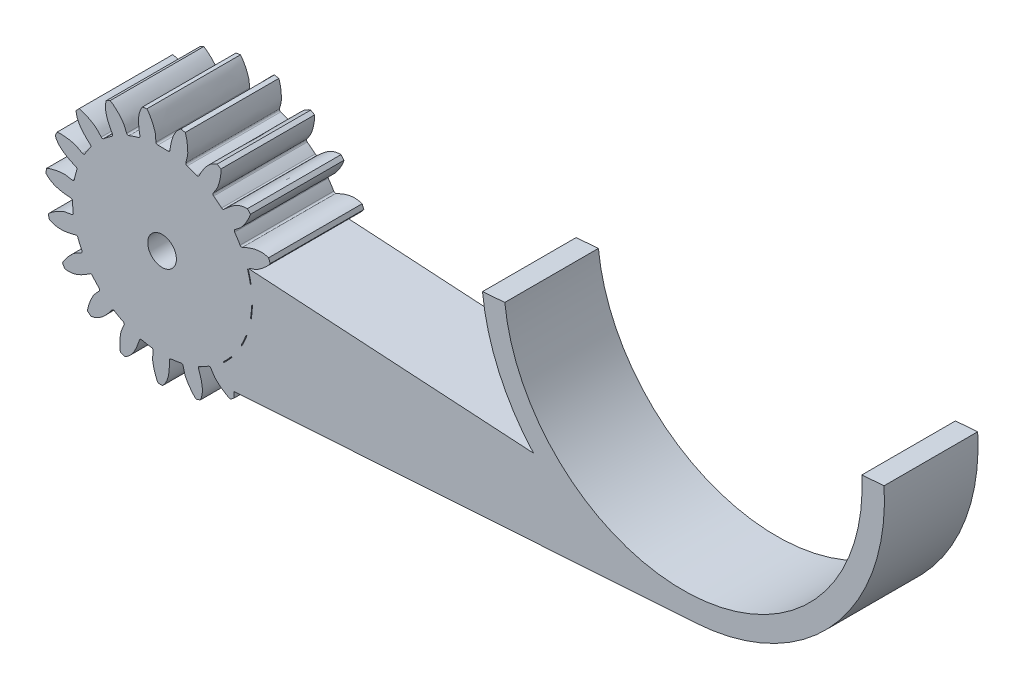
from build123d import *

# Parameters (mm, degrees)
SKETCH_3_R               = 13
SKETCH_3_R_2             = 10
EXTRUDE_1_DEPTH          = 4
CUT_EXTRUDE_2_DEPTH      = 19.814887722
PATTERN_CIRCULAR_4_COUNT = 19
CUT_EXTRUDE_4_DEPTH      = 19.804447773
CUT_EXTRUDE_4_DEPTH_BACK = 19.804447773
SKETCH_8_R               = 4.05
SKETCH_10_R              = 4.5
CUT_EXTRUDE_5_DEPTH      = 0.6
CUT_EXTRUDE_START        = -0.6
SKETCH_11_R              = 4.5
CUT_EXTRUDE_6_DEPTH      = 0.6
EXTRUDE_START            = 6.45
EXTRUDE_6_DEPTH          = 6.45
CUT_EXTRUDE_7_DEPTH      = 20.473308824
CUT_EXTRUDE_7_DEPTH_BACK = 20.473308824
SKETCH_16_R              = 1.6
EXTRUDE_7_DEPTH          = 4
EXTRUDE_8_DEPTH          = 6.45


with BuildPart() as part:
    # 草图3 → 凸台-拉伸1 (new body)
    # profile 1 of 2: a face of its own
    with BuildSketch(Plane.XY):
        Circle(SKETCH_3_R)
        Circle(SKETCH_3_R_2, mode=Mode.SUBTRACT)
    # profile 2 of 2: a face of its own
    with BuildSketch(Plane.XY):
        Circle(SKETCH_3_R_2)
    extrude(amount=EXTRUDE_1_DEPTH)

    # 草图6 → 切除-拉伸2 (cut, symmetric)
    with BuildSketch(Plane.XY.offset(4)):
        with BuildLine():
            Line((-1.696840499, 12.888783198), (-1.873622587, 14.231576474))
            Line((-1.873622587, 14.231576474), (3.000861464, 14.403965519))
            Line((3.000861464, 14.403965519), (2.084995297, 12.83171051))
            add(Edge.make_bspline(
                [(2.084995297, 12.83171051), (1.471750903, 12.385409064), (1.073531879, 11.424223458), (0.908091171, 10.424013275), (0.866775265, 10.148389403)],
                knots=[0, 0, 0, 0, 0.67611985, 0.94077492, 0.94077492, 0.94077492, 0.94077492], degree=3))
            ThreePointArc((0.866775265, 10.148389403), (0.794461275, 10.022295574), (0.655867727, 9.978468696))
            ThreePointArc((0.655867727, 9.978468696), (0.089873577, 9.999596129), (-0.476408885, 9.988645282))
            ThreePointArc((-0.476408885, 9.988645282), (-0.618800498, 10.03892803), (-0.685447576, 10.174434093))
            add(Edge.make_bspline(
                [(-1.696840499, 12.888783198), (-1.34037548, 12.491366053), (-0.721854022, 11.223575025), (-0.721476087, 10.688451407), (-0.685447576, 10.174434093)],
                knots=[0, 0, 0, 0, 0.6442443, 0.94077492, 0.94077492, 0.94077492, 0.94077492], degree=3))
        make_face()
    cut_extrude_2 = extrude(amount=CUT_EXTRUDE_2_DEPTH, both=True, mode=Mode.SUBTRACT)

    # 阵列(圆周)4: 切除-拉伸2 ×19 about axis
    pattern_circular_4_axis = Axis((0, 0, 4), (0, 0, 1))
    for i in range(1, PATTERN_CIRCULAR_4_COUNT):
        add(cut_extrude_2.rotate(pattern_circular_4_axis, i * 360 / PATTERN_CIRCULAR_4_COUNT), mode=Mode.SUBTRACT)

    # 草图8 → 切除-拉伸4 (cut, two sides: drawn at the far end of the back side and taken through both)
    with BuildSketch(Plane(origin=(0, 0, 0), x_dir=(-1, 0, 0), z_dir=(0, 0, -1)).offset(-CUT_EXTRUDE_4_DEPTH_BACK)):
        Circle(SKETCH_8_R)
    extrude(amount=CUT_EXTRUDE_4_DEPTH + CUT_EXTRUDE_4_DEPTH_BACK, mode=Mode.SUBTRACT)

    # 草图10 → 切除-拉伸5 (cut)
    with BuildSketch(Plane(origin=(0, 0, 0), x_dir=(-1, 0, 0), z_dir=(0, 0, -1))):
        Circle(SKETCH_10_R)
    extrude(amount=-CUT_EXTRUDE_5_DEPTH, mode=Mode.SUBTRACT)

    # 草图11 → 切除-拉伸6 (cut)
    with BuildSketch(Plane.XY.offset(4).offset(CUT_EXTRUDE_START)):
        with Locations(Location((0, 0, 0), (0, 0, 180))):
            Circle(SKETCH_11_R)
    extrude(amount=CUT_EXTRUDE_6_DEPTH, mode=Mode.SUBTRACT)

    # 草图15 → 凸台-拉伸6 (add)
    with BuildSketch(Plane.XY.offset(4).offset(EXTRUDE_START)):
        with BuildLine():
            ThreePointArc((10.631824778, -7.480929213), (10.774633528, -7.27373854), (10.913405149, -7.063822482))
            add(Edge.make_bspline(
                [(10.913405149, -7.063822482), (10.751031656, -6.322952374), (10.030766276, -5.572170153), (9.181257245, -5.018884111), (8.945444665, -4.870331258)],
                knots=[0, 0, 0, 0, 0.67611985, 0.94077492, 0.94077492, 0.94077492, 0.94077492], degree=3))
            ThreePointArc((8.945444665, -4.870331258), (8.8590195, -4.753456721), (8.874556408, -4.608931391))
            ThreePointArc((8.874556408, -4.608931391), (9.121261608, -4.099095838), (9.338706188, -3.576110559))
            ThreePointArc((9.338706188, -3.576110559), (9.441951847, -3.465910467), (9.592816512, -3.459309017))
            add(Edge.make_bspline(
                [(9.592816512, -3.459309017), (10.078012345, -3.63279347), (10.568216095, -3.847404077), (11.977682543, -3.790244479), (12.48481693, -3.623443971)],
                knots=[0, 0, 0, 0, 0.29653062, 0.94077492, 0.94077492, 0.94077492, 0.94077492], degree=3))
            ThreePointArc((12.48481693, -3.623443971), (12.552613207, -3.381109535), (12.615706166, -3.137508236))
            add(Edge.make_bspline(
                [(12.615706166, -3.137508236), (12.221570386, -2.489503102), (11.296552383, -2.013270119), (10.31342041, -1.765797772), (10.042149774, -1.701862142)],
                knots=[0, 0, 0, 0, 0.67611985, 0.94077492, 0.94077492, 0.94077492, 0.94077492], degree=3))
            ThreePointArc((10.042149774, -1.701862142), (9.922458262, -1.619382395), (9.890226039, -1.47764302))
            ThreePointArc((9.890226039, -1.47764302), (9.958020737, -0.915326716), (9.993870528, -0.350074083))
            ThreePointArc((9.993870528, -0.350074083), (10.055740141, -0.212321125), (10.196287055, -0.157091683))
            add(Edge.make_bspline(
                [(10.196287055, -0.157091683), (10.711523949, -0.16363344), (11.244851058, -0.207446955), (12.559389035, 0.304268585), (12.984885446, 0.626697648)],
                knots=[0, 0, 0, 0, 0.29653062, 0.94077492, 0.94077492, 0.94077492, 0.94077492], degree=3))
            ThreePointArc((12.984885446, 0.626697648), (12.97032247, 0.877915151), (12.950899667, 1.12880371))
            add(Edge.make_bspline(
                [(12.950899667, 1.12880371), (12.367712328, 1.61372246), (11.338181754, 1.763798972), (10.327964444, 1.678640154), (10.050632134, 1.651030144)],
                knots=[0, 0, 0, 0, 0.67611985, 0.94077492, 0.94077492, 0.94077492, 0.94077492], degree=3))
            ThreePointArc((10.050632134, 1.651030144), (9.910644708, 1.69017714), (9.834136216, 1.8137709))
            ThreePointArc((9.834136216, 1.8137709), (9.715673805, 2.367632258), (9.566043926, 2.913898353))
            ThreePointArc((9.566043926, 2.913898353), (9.57983296, 3.064276505), (9.694831684, 3.162148972))
            add(Edge.make_bspline(
                [(9.694831684, 3.162148972), (10.184275727, 3.323258811), (10.702931927, 3.454990263), (11.780090846, 4.365809427), (12.077840143, 4.808926853)],
                knots=[0, 0, 0, 0, 0.29653062, 0.94077492, 0.94077492, 0.94077492, 0.94077492], degree=3))
            ThreePointArc((12.077840143, 4.808926853), (11.982496039, 5.041804108), (11.882662235, 5.272792259))
            add(Edge.make_bspline(
                [(11.882662235, 5.272792259), (11.173620733, 5.542076154), (10.151143203, 5.349733076), (9.223313276, 4.941171373), (8.969972551, 4.825007696)],
                knots=[0, 0, 0, 0, 0.67611985, 0.94077492, 0.94077492, 0.94077492, 0.94077492], degree=3))
            ThreePointArc((8.969972551, 4.825007696), (8.824859021, 4.816579757), (8.712365142, 4.908634599))
            ThreePointArc((8.712365142, 4.908634599), (8.420482862, 5.394021539), (8.101588032, 5.862104687))
            ThreePointArc((8.101588032, 5.862104687), (8.065802231, 6.008812229), (8.142790869, 6.138721721))
            add(Edge.make_bspline(
                [(8.142790869, 6.138721721), (8.553403205, 6.450024405), (9.001184049, 6.743025677), (9.724237028, 7.954247075), (9.861973453, 8.470034215)],
                knots=[0, 0, 0, 0, 0.29653062, 0.94077492, 0.94077492, 0.94077492, 0.94077492], degree=3))
            ThreePointArc((9.861973453, 8.470034215), (9.696180235, 8.659335359), (9.526753972, 8.845391951))
            add(Edge.make_bspline(
                [(9.526753972, 8.845391951), (8.768693956, 8.869859903), (7.864070774, 8.355940591), (7.119173, 7.668250004), (6.917277258, 7.476120796)],
                knots=[0, 0, 0, 0, 0.67611985, 0.94077492, 0.94077492, 0.94077492, 0.94077492], degree=3))
            ThreePointArc((6.917277258, 7.476120796), (6.782762927, 7.42103122), (6.646474119, 7.471571574))
            ThreePointArc((6.646474119, 7.471571574), (6.212801944, 7.83588489), (5.759199365, 8.17506102))
            ThreePointArc((5.759199365, 8.17506102), (5.677716677, 8.302199912), (5.708352315, 8.450068718))
            add(Edge.make_bspline(
                [(5.708352315, 8.450068718), (5.995636726, 8.877829772), (6.324018211, 9.300349629), (6.61461124, 10.68071863), (6.577408916, 11.213281944)],
                knots=[0, 0, 0, 0, 0.29653062, 0.94077492, 0.94077492, 0.94077492, 0.94077492], degree=3))
            ThreePointArc((6.577408916, 11.213281944), (6.35913285, 11.338493259), (6.138474093, 11.459456174))
            add(Edge.make_bspline(
                [(6.138474093, 11.459456174), (5.413543129, 11.236456701), (4.724804254, 10.456652288), (4.243559864, 9.564354762), (4.114987643, 9.317080204)],
                knots=[0, 0, 0, 0, 0.67611985, 0.94077492, 0.94077492, 0.94077492, 0.94077492], degree=3))
            ThreePointArc((4.114987643, 9.317080204), (4.005649225, 9.221298802), (3.860334494, 9.224847836))
            ThreePointArc((3.860334494, 9.224847836), (3.331867534, 9.428608526), (2.792712084, 9.602122641))
            ThreePointArc((2.792712084, 9.602122641), (2.674362422, 9.695915412), (2.655325214, 9.845719654))
            add(Edge.make_bspline(
                [(2.655325214, 9.845719654), (2.788149975, 10.34358453), (2.961546873, 10.84983639), (2.788189688, 12.249768592), (2.580080063, 12.741396582)],
                knots=[0, 0, 0, 0, 0.29653062, 0.94077492, 0.94077492, 0.94077492, 0.94077492], degree=3))
            ThreePointArc((2.580080063, 12.741396582), (2.332974749, 12.788949481), (2.084995297, 12.83171051))
            add(Edge.make_bspline(
                [(2.084995297, 12.83171051), (1.471750903, 12.385409064), (1.073531879, 11.424223458), (0.908091171, 10.424013275), (0.866775265, 10.148389403)],
                knots=[0, 0, 0, 0, 0.67611985, 0.94077492, 0.94077492, 0.94077492, 0.94077492], degree=3))
            ThreePointArc((0.866775265, 10.148389403), (0.794461275, 10.022295574), (0.655867727, 9.978468696))
            ThreePointArc((0.655867727, 9.978468696), (0.089873577, 9.999596129), (-0.476408885, 9.988645282))
            ThreePointArc((-0.476408885, 9.988645282), (-0.618800498, 10.03892803), (-0.685447576, 10.174434093))
            add(Edge.make_bspline(
                [(-0.685447576, 10.174434093), (-0.721476087, 10.688451407), (-0.721854022, 11.223575025), (-1.34037548, 12.491366053), (-1.696840499, 12.888783198)],
                knots=[0, 0, 0, 0, 0.29653062, 0.94077492, 0.94077492, 0.94077492, 0.94077492], degree=3))
            ThreePointArc((-1.696840499, 12.888783198), (-1.945997366, 12.853524585), (-2.194425091, 12.813449907))
            add(Edge.make_bspline(
                [(-2.194425091, 12.813449907), (-2.629528369, 12.192210175), (-2.694074332, 11.153802751), (-2.525783291, 10.154068204), (-2.475365662, 9.879963141)],
                knots=[0, 0, 0, 0, 0.67611985, 0.94077492, 0.94077492, 0.94077492, 0.94077492], degree=3))
            ThreePointArc((-2.475365662, 9.879963141), (-2.502818882, 9.73722111), (-2.619672484, 9.650767642))
            ThreePointArc((-2.619672484, 9.650767642), (-3.161859577, 9.486972331), (-3.693903558, 9.292743217))
            ThreePointArc((-3.693903558, 9.292743217), (-3.844906783, 9.294067025), (-3.951941485, 9.400590726))
            add(Edge.make_bspline(
                [(-3.951941485, 9.400590726), (-4.152919021, 9.875058725), (-4.327030833, 10.381065154), (-5.323690166, 11.379330179), (-5.789882063, 11.639470164)],
                knots=[0, 0, 0, 0, 0.29653062, 0.94077492, 0.94077492, 0.94077492, 0.94077492], degree=3))
            ThreePointArc((-5.789882063, 11.639470164), (-6.014090471, 11.525220857), (-6.23604547, 11.406653186))
            add(Edge.make_bspline(
                [(-6.23604547, 11.406653186), (-6.445857441, 10.677796132), (-6.169735786, 9.674694447), (-5.685949941, 8.783772287), (-5.54926231, 8.540889569)],
                knots=[0, 0, 0, 0, 0.67611985, 0.94077492, 0.94077492, 0.94077492, 0.94077492], degree=3))
            ThreePointArc((-5.54926231, 8.540889569), (-5.528879777, 8.39696765), (-5.611330534, 8.277256166))
            ThreePointArc((-5.611330534, 8.277256166), (-6.070956184, 7.946287876), (-6.511106465, 7.589828233))
            ThreePointArc((-6.511106465, 7.589828233), (-6.654357758, 7.542049646), (-6.790181214, 7.608047488))
            add(Edge.make_bspline(
                [(-6.790181214, 7.608047488), (-7.13432874, 7.991550203), (-7.463306713, 8.413605795), (-8.730100418, 9.034167311), (-9.255500067, 9.128839932)],
                knots=[0, 0, 0, 0, 0.29653062, 0.94077492, 0.94077492, 0.94077492, 0.94077492], degree=3))
            ThreePointArc((-9.255500067, 9.128839932), (-9.430463555, 8.947980617), (-9.60189356, 8.763768599))
            add(Edge.make_bspline(
                [(-9.60189356, 8.763768599), (-9.563677842, 8.006277195), (-8.976810635, 7.147182881), (-8.229955689, 6.461618348), (-8.021810282, 6.276278088)],
                knots=[0, 0, 0, 0, 0.67611985, 0.94077492, 0.94077492, 0.94077492, 0.94077492], degree=3))
            ThreePointArc((-8.021810282, 6.276278088), (-7.955800759, 6.146772452), (-7.994913852, 6.00677555))
            ThreePointArc((-7.994913852, 6.00677555), (-8.322170488, 5.54449983), (-8.622729956, 5.064437591))
            ThreePointArc((-8.622729956, 5.064437591), (-8.742705817, 4.972734162), (-8.892599447, 4.991054254))
            add(Edge.make_bspline(
                [(-8.892599447, 4.991054254), (-9.342623239, 5.242033215), (-9.790817505, 5.534401698), (-11.190468827, 5.710012235), (-11.718141024, 5.628958246)],
                knots=[0, 0, 0, 0, 0.29653062, 0.94077492, 0.94077492, 0.94077492, 0.94077492], degree=3))
            ThreePointArc((-11.718141024, 5.628958246), (-11.824899585, 5.401087836), (-11.927227495, 5.171193701))
            add(Edge.make_bspline(
                [(-11.927227495, 5.171193701), (-11.645125353, 4.467153894), (-10.811108762, 3.84516315), (-9.882118037, 3.439247799), (-9.625070638, 3.331534489)],
                knots=[0, 0, 0, 0, 0.67611985, 0.94077492, 0.94077492, 0.94077492, 0.94077492], degree=3))
            ThreePointArc((-9.625070638, 3.331534489), (-9.520587282, 3.230479082), (-9.512124199, 3.085367598))
            ThreePointArc((-9.512124199, 3.085367598), (-9.671548488, 2.541879196), (-9.79994686, 1.990236553))
            ThreePointArc((-9.79994686, 1.990236553), (-9.883646043, 1.86454577), (-10.031366548, 1.833202847))
            add(Edge.make_bspline(
                [(-10.031366548, 1.833202847), (-10.538499545, 1.924460589), (-11.0573413, 2.055459301), (-12.438176302, 1.767088734), (-12.910939576, 1.519091591)],
                knots=[0, 0, 0, 0, 0.29653062, 0.94077492, 0.94077492, 0.94077492, 0.94077492], degree=3))
            ThreePointArc((-12.910939576, 1.519091591), (-12.937924262, 1.26890338), (-12.96006126, 1.018239726))
            add(Edge.make_bspline(
                [(-12.96006126, 1.018239726), (-12.464642839, 0.443945154), (-11.473855503, 0.126460328), (-10.463399559, 0.044181386), (-10.185305242, 0.025767433)],
                knots=[0, 0, 0, 0, 0.67611985, 0.94077492, 0.94077492, 0.94077492, 0.94077492], degree=3))
            ThreePointArc((-10.185305242, 0.025767433), (-10.053670446, -0.035886822), (-9.998548294, -0.170387807))
            ThreePointArc((-9.998548294, -0.170387807), (-9.972864139, -0.736193491), (-9.915187461, -1.299637496))
            ThreePointArc((-9.915187461, -1.299637496), (-9.953539861, -1.445695087), (-10.08307943, -1.523304533))
            add(Edge.make_bspline(
                [(-10.08307943, -1.523304533), (-10.592365903, -1.601657202), (-11.125630593, -1.646224004), (-12.338014375, -2.367326251), (-12.704637491, -2.755392209)],
                knots=[0, 0, 0, 0, 0.29653062, 0.94077492, 0.94077492, 0.94077492, 0.94077492], degree=3))
            ThreePointArc((-12.704637491, -2.755392209), (-12.648924093, -3.000786445), (-12.588471292, -3.245056323))
            add(Edge.make_bspline(
                [(-12.588471292, -3.245056323), (-11.933422864, -3.627371933), (-10.893231964, -3.605946433), (-9.910809382, -3.355672766), (-9.641803982, -3.282791923)],
                knots=[0, 0, 0, 0, 0.67611985, 0.94077492, 0.94077492, 0.94077492, 0.94077492], degree=3))
            ThreePointArc((-9.641803982, -3.282791923), (-9.497282418, -3.298363832), (-9.401474538, -3.40767905))
            ThreePointArc((-9.401474538, -3.40767905), (-9.193465217, -3.934488189), (-8.95596365, -4.448675658))
            ThreePointArc((-8.95596365, -4.448675658), (-8.944813189, -4.599272449), (-9.042134201, -4.714738231))
            add(Edge.make_bspline(
                [(-9.042134201, -4.714738231), (-9.498385058, -4.954210583), (-9.988285179, -5.169513395), (-10.900837147, -6.245204703), (-11.121590801, -6.731286508)],
                knots=[0, 0, 0, 0, 0.29653062, 0.94077492, 0.94077492, 0.94077492, 0.94077492], degree=3))
            ThreePointArc((-11.121590801, -6.731286508), (-10.98921673, -6.945294498), (-10.852725129, -7.156700167))
            add(Edge.make_bspline(
                [(-10.852725129, -7.156700167), (-10.109031356, -7.305606986), (-9.132157717, -6.947592946), (-8.284229227, -6.391887706), (-8.053463652, -6.235609836)],
                knots=[0, 0, 0, 0, 0.67611985, 0.94077492, 0.94077492, 0.94077492, 0.94077492], degree=3))
            ThreePointArc((-8.053463652, -6.235609836), (-7.911716475, -6.203411942), (-7.785605137, -6.275695392))
            ThreePointArc((-7.785605137, -6.275695392), (-7.417811686, -6.706420043), (-7.026222211, -7.115630783))
            ThreePointArc((-7.026222211, -7.115630783), (-6.966777215, -7.254447276), (-7.021333428, -7.395256884))
            add(Edge.make_bspline(
                [(-7.021333428, -7.395256884), (-7.37510681, -7.769898375), (-7.768554082, -8.132605796), (-8.282385071, -9.446318322), (-8.333347178, -9.977741468)],
                knots=[0, 0, 0, 0, 0.29653062, 0.94077492, 0.94077492, 0.94077492, 0.94077492], degree=3))
            ThreePointArc((-8.333347178, -9.977741468), (-8.138657219, -10.137172124), (-7.940917801, -10.2928045))
            add(Edge.make_bspline(
                [(-7.940917801, -10.2928045), (-7.189169443, -10.192166164), (-6.381472481, -9.53635996), (-5.759924291, -8.735442432), (-5.592405573, -8.512702669)],
                knots=[0, 0, 0, 0, 0.67611985, 0.94077492, 0.94077492, 0.94077492, 0.94077492], degree=3))
            ThreePointArc((-5.592405573, -8.512702669), (-5.468793288, -8.436224112), (-5.326044613, -8.463642761))
            ThreePointArc((-5.326044613, -8.463642761), (-4.838323161, -8.751607223), (-4.335080573, -9.011496903))
            ThreePointArc((-4.335080573, -9.011496903), (-4.233782829, -9.123490176), (-4.239662231, -9.274384705))
            add(Edge.make_bspline(
                [(-4.239662231, -9.274384705), (-4.452621302, -9.743597116), (-4.706979609, -10.214404169), (-4.766408057, -11.623776776), (-4.642056084, -12.142953319)],
                knots=[0, 0, 0, 0, 0.29653062, 0.94077492, 0.94077492, 0.94077492, 0.94077492], degree=3))
            ThreePointArc((-4.642056084, -12.142953319), (-4.406147914, -12.230529856), (-4.168588813, -12.313523757))
            add(Edge.make_bspline(
                [(-4.168588813, -12.313523757), (-3.490249469, -11.97424599), (-2.939255683, -11.0917144), (-2.611442185, -10.132376426), (-2.525323576, -9.867312079)],
                knots=[0, 0, 0, 0, 0.67611985, 0.94077492, 0.94077492, 0.94077492, 0.94077492], degree=3))
            ThreePointArc((-2.525323576, -9.867312079), (-2.433241492, -9.754840498), (-2.289324513, -9.734423109))
            ThreePointArc((-2.289324513, -9.734423109), (-1.734527246, -9.848421967), (-1.174165689, -9.930827505))
            ThreePointArc((-1.174165689, -9.930827505), (-1.04199238, -10.00386135), (-0.998557846, -10.148489036))
            add(Edge.make_bspline(
                [(-0.998557846, -10.148489036), (-1.047625186, -10.661425922), (-1.135330859, -11.189313357), (-0.733916772, -12.541618654), (-0.447726184, -12.992287761)],
                knots=[0, 0, 0, 0, 0.29653062, 0.94077492, 0.94077492, 0.94077492, 0.94077492], degree=3))
            ThreePointArc((-0.447726184, -12.992287761), (-0.196164114, -12.998519902), (0.055471455, -12.99988165))
            add(Edge.make_bspline(
                [(0.055471455, -12.99988165), (0.586893191, -12.458730464), (0.821475076, -11.44510948), (0.820030203, -10.431310214), (0.815416416, -10.152645118)],
                knots=[0, 0, 0, 0, 0.67611985, 0.94077492, 0.94077492, 0.94077492, 0.94077492], degree=3))
            ThreePointArc((0.815416416, -10.152645118), (0.865989775, -10.016368554), (0.99547942, -9.950327669))
            ThreePointArc((0.99547942, -9.950327669), (1.55723161, -9.878007376), (2.113988266, -9.773998855))
            ThreePointArc((2.113988266, -9.773998855), (2.262714112, -9.800158922), (2.350755776, -9.922847111))
            add(Edge.make_bspline(
                [(2.350755776, -9.922847111), (2.470897374, -10.4239238), (2.559348607, -10.951686823), (3.378105783, -12.100381549), (3.795121796, -12.433706228)],
                knots=[0, 0, 0, 0, 0.29653062, 0.94077492, 0.94077492, 0.94077492, 0.94077492], degree=3))
            ThreePointArc((3.795121796, -12.433706228), (4.035077111, -12.357918624), (4.27352053, -12.277500653))
            add(Edge.make_bspline(
                [(4.27352053, -12.277500653), (4.600436868, -11.593118175), (4.493186263, -10.558249358), (4.162639595, -9.599849683), (4.067793386, -9.337781524)],
                knots=[0, 0, 0, 0, 0.67611985, 0.94077492, 0.94077492, 0.94077492, 0.94077492], degree=3))
            ThreePointArc((4.067793386, -9.337781524), (4.071377613, -9.192467657), (4.172407712, -9.087959831))
            ThreePointArc((4.172407712, -9.087959831), (4.680240257, -8.837157412), (5.173058791, -8.558005769))
            ThreePointArc((5.173058791, -8.558005769), (5.32222042, -8.534457208), (5.445328533, -8.621910731))
            add(Edge.make_bspline(
                [(5.445328533, -8.621910731), (5.721659864, -9.05682779), (5.976682938, -9.527275089), (7.12405816, -10.347880345), (7.626709441, -10.527739696)],
                knots=[0, 0, 0, 0, 0.29653062, 0.94077492, 0.94077492, 0.94077492, 0.94077492], degree=3))
            ThreePointArc((7.626709441, -10.527739696), (7.829055121, -10.37814511), (8.028467345, -10.224661955))
            add(Edge.make_bspline(
                [(8.028467345, -10.224661955), (8.115451827, -9.471211646), (7.677991, -8.52723909), (7.054162396, -7.728096481), (6.879361825, -7.511024412)],
                knots=[0, 0, 0, 0, 0.67611985, 0.94077492, 0.94077492, 0.94077492, 0.94077492], degree=3))
            ThreePointArc((6.879361825, -7.511024412), (6.835568513, -7.372420254), (6.897190887, -7.24077053))
            ThreePointArc((6.897190887, -7.24077053), (7.296072252, -6.838664321), (7.671548128, -6.414619967))
            ThreePointArc((7.671548128, -6.414619967), (7.804981563, -6.343914631), (7.949815452, -6.386656542))
            add(Edge.make_bspline(
                [(7.949815452, -6.386656542), (8.352391726, -6.708283958), (8.746350935, -7.070435268), (10.098008294, -7.474025743), (10.631824778, -7.480929213)],
                knots=[0, 0, 0, 0, 0.29653062, 0.94077492, 0.94077492, 0.94077492, 0.94077492], degree=3))
        make_face()
    extrude(amount=-EXTRUDE_6_DEPTH)

    # 草图16 → 切除-拉伸7 (cut, two sides: drawn at the far end of the back side and taken through both)
    with BuildSketch(Plane(origin=(0, 0, 4), x_dir=(-1, 0, 0), z_dir=(0, 0, -1)).offset(-CUT_EXTRUDE_7_DEPTH_BACK)):
        Circle(SKETCH_16_R)
    extrude(amount=CUT_EXTRUDE_7_DEPTH + CUT_EXTRUDE_7_DEPTH_BACK, mode=Mode.SUBTRACT)

    # 草图9 → 凸台-拉伸7 (add)
    with BuildSketch(Plane.XY.offset(4)):
        with BuildLine():
            Line((41.469504545, 1.174450257), (9.591505018, 3.118859533))
            ThreePointArc((9.591505018, 3.118859533), (8.394175811, -5.591249033), (0.818167827, -10.052604374))
            Line((0.818167827, -10.052604374), (59.631321788, -6.180360743))
            ThreePointArc((59.631321788, -6.180360743), (75.023681828, 1.383639121), (80.613996955, 17.597436279))
            Line((80.613996955, 17.597436279), (78.121543738, 17.394578895))
            ThreePointArc((78.121543738, 17.394578895), (59.775535953, -3.663056261), (38.265832142, 14.15077662))
            Line((38.265832142, 14.15077662), (35.773378925, 13.947919236))
            ThreePointArc((35.773378925, 13.947919236), (37.603744887, 7.107359), (41.469504545, 1.174450257))
        make_face()
    extrude(amount=-EXTRUDE_7_DEPTH)

    # 草图17 → 凸台-拉伸8 (add)
    with BuildSketch(Plane.XY.offset(4).offset(EXTRUDE_START)):
        with BuildLine():
            Line((8.008792069, -9.579175438), (59.631321788, -6.180360743))
            ThreePointArc((59.631321788, -6.180360743), (75.023681828, 1.383639121), (80.613996955, 17.597436279))
            Line((80.613996955, 17.597436279), (78.121543738, 17.394578895))
            ThreePointArc((78.121543738, 17.394578895), (59.775535953, -3.663056261), (38.265832142, 14.15077662))
            Line((38.265832142, 14.15077662), (35.773378925, 13.947919236))
            ThreePointArc((35.773378925, 13.947919236), (37.603744887, 7.107359), (41.469504545, 1.174450257))
            Line((41.469504545, 1.174450257), (9.619584013, 3.117146846))
            ThreePointArc((9.619584013, 3.117146846), (9.609026175, 3.106324189), (9.599316084, 3.094734885))
            ThreePointArc((9.599316084, 3.094734885), (9.799077233, 2.387957008), (9.946874283, 1.668515895))
            ThreePointArc((9.946874283, 1.668515895), (9.99758268, 1.652827274), (10.050632134, 1.651030144))
            add(Edge.make_bspline(
                [(10.050632134, 1.651030144), (10.327964444, 1.678640154), (11.338181754, 1.763798972), (12.367712328, 1.61372246), (12.950899667, 1.12880371)],
                knots=[0, 0, 0, 0, 0.26465507, 0.94077492, 0.94077492, 0.94077492, 0.94077492], degree=3))
            ThreePointArc((12.950899667, 1.12880371), (12.97032247, 0.877915151), (12.984885446, 0.626697648))
            add(Edge.make_bspline(
                [(12.984885446, 0.626697648), (12.559389035, 0.304268585), (11.244851058, -0.207446955), (10.711523949, -0.16363344), (10.196287055, -0.157091683)],
                knots=[0, 0, 0, 0, 0.6442443, 0.94077492, 0.94077492, 0.94077492, 0.94077492], degree=3))
            ThreePointArc((10.196287055, -0.157091683), (10.137726021, -0.165081959), (10.084057436, -0.189839224))
            ThreePointArc((10.084057436, -0.189839224), (10.043504573, -0.923184265), (9.949691423, -1.651633699))
            ThreePointArc((9.949691423, -1.651633699), (9.992558212, -1.682937256), (10.042149774, -1.701862142))
            add(Edge.make_bspline(
                [(10.042149774, -1.701862142), (10.31342041, -1.765797772), (11.296552383, -2.013270119), (12.221570386, -2.489503102), (12.615706166, -3.137508236)],
                knots=[0, 0, 0, 0, 0.26465507, 0.94077492, 0.94077492, 0.94077492, 0.94077492], degree=3))
            ThreePointArc((12.615706166, -3.137508236), (12.552613207, -3.381109535), (12.48481693, -3.623443971))
            add(Edge.make_bspline(
                [(12.48481693, -3.623443971), (11.977682543, -3.790244479), (10.568216095, -3.847404077), (10.078012345, -3.63279347), (9.592816512, -3.459309017)],
                knots=[0, 0, 0, 0, 0.6442443, 0.94077492, 0.94077492, 0.94077492, 0.94077492], degree=3))
            ThreePointArc((9.592816512, -3.459309017), (9.534834038, -3.447851621), (9.476034694, -3.453841308))
            ThreePointArc((9.476034694, -3.453841308), (9.199562351, -4.134284199), (8.874305113, -4.792803153))
            ThreePointArc((8.874305113, -4.792803153), (8.904685012, -4.836329421), (8.945444665, -4.870331258))
            add(Edge.make_bspline(
                [(8.945444665, -4.870331258), (9.181257245, -5.018884111), (10.030766276, -5.572170153), (10.751031656, -6.322952374), (10.913405149, -7.063822482)],
                knots=[0, 0, 0, 0, 0.26465507, 0.94077492, 0.94077492, 0.94077492, 0.94077492], degree=3))
            ThreePointArc((10.913405149, -7.063822482), (10.774633528, -7.27373854), (10.631824778, -7.480929213))
            add(Edge.make_bspline(
                [(10.631824778, -7.480929213), (10.098008294, -7.474025743), (8.746350935, -7.070435268), (8.352391726, -6.708283958), (7.949815452, -6.386656542)],
                knots=[0, 0, 0, 0, 0.6442443, 0.94077492, 0.94077492, 0.94077492, 0.94077492], degree=3))
            ThreePointArc((7.949815452, -6.386656542), (7.898694838, -6.356993061), (7.841136557, -6.343566095))
            ThreePointArc((7.841136557, -6.343566095), (7.358704803, -6.89737029), (6.837250144, -7.414598018))
            ThreePointArc((6.837250144, -7.414598018), (6.851851021, -7.46563025), (6.879361825, -7.511024412))
            add(Edge.make_bspline(
                [(6.879361825, -7.511024412), (7.054162396, -7.728096481), (7.546097304, -8.358279425), (7.922139657, -9.078524679), (8.008792069, -9.579175438)],
                knots=[0, 0, 0, 0, 0.26465507, 0.741870477, 0.741870477, 0.741870477, 0.741870477], degree=3))
        make_face()
    extrude(amount=-EXTRUDE_8_DEPTH)


solid = part.part
